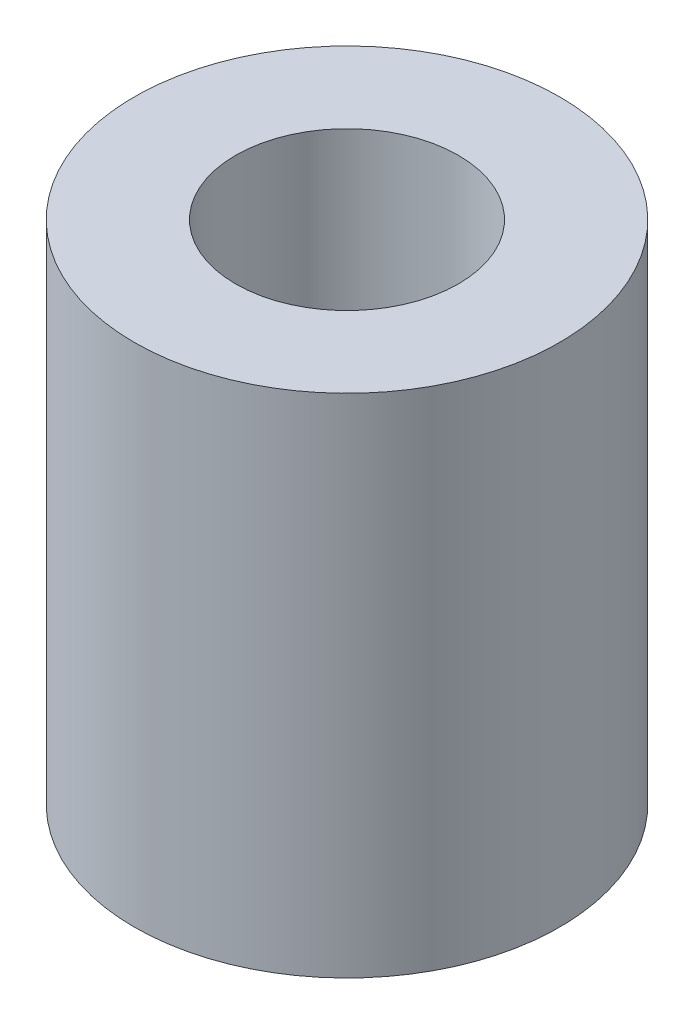
from build123d import *

# Parameters (mm, degrees)
SKETCH1_R           = 2.1
SKETCH1_R_2         = 1.1
BOSS_EXTRUDE1_DEPTH = 5


with BuildPart() as part:
    # Sketch1 → Boss-Extrude1 (new body)
    with BuildSketch(Plane(origin=(0, 0, 0), x_dir=(1, 0, 0), z_dir=(0, 1, 0))):
        with Locations(Location((0, 0, 0), (0, 0, 270))):
            Circle(SKETCH1_R)
        with Locations(Location((0, 0, 0), (0, 0, 270))):
            Circle(SKETCH1_R_2, mode=Mode.SUBTRACT)
    extrude(amount=BOSS_EXTRUDE1_DEPTH)


solid = part.part
